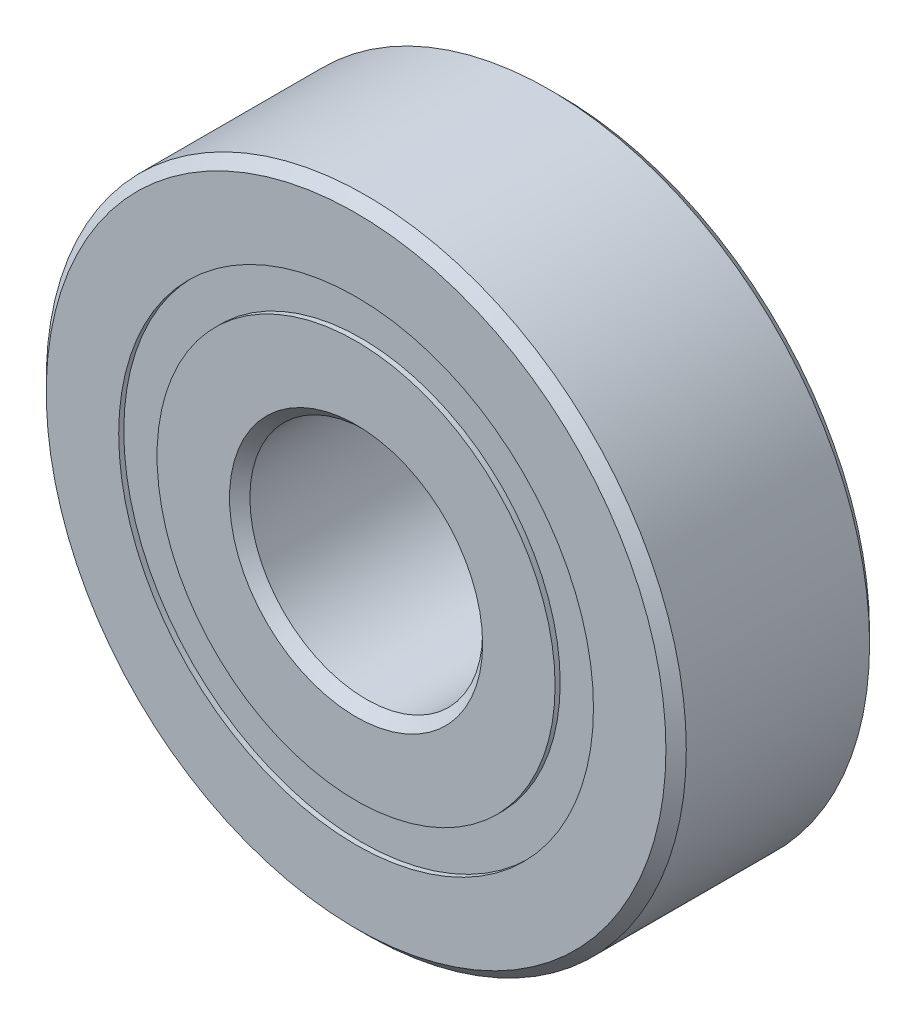
from build123d import *

# Parameters (mm, degrees)
CIRPATTERN1_COUNT = 14
SKETCH6_W         = 1.635478413
SKETCH6_H         = 1.318681318


with BuildPart() as part:
    # Sketch1 → Revolve1 (revolve)
    with BuildSketch(Plane(origin=(0, 0, 0), x_dir=(0, 0, -1), z_dir=(1, 0, 0)), mode=Mode.PRIVATE) as revolve1_sk:
        with BuildLine():
            Line((3.15, 11), (-3.15, 11))
            Line((-3.15, 11), (-3.5, 10.65))
            Line((-3.5, 10.65), (-3.5, 8.159340659))
            Line((-3.5, 8.159340659), (-1.555555556, 8.159340659))
            ThreePointArc((-1.555555556, 8.159340659), (0, 9.189521587), (1.555555556, 8.159340659))
            Line((1.555555556, 8.159340659), (3.5, 8.159340659))
            Line((3.5, 8.159340659), (3.5, 10.65))
            Line((3.5, 10.65), (3.15, 11))
        make_face()
    revolve(revolve1_sk.sketch.rotate(Axis((0, 0, 3.5), (0, 0, -1)), 90), axis=Axis((0, 0, 3.5), (0, 0, -1)))


with BuildPart() as body_2:
    # Sketch3 → Revolve3 (revolve)
    with BuildSketch(Plane(origin=(0, 0, 0), x_dir=(0, 0, -1), z_dir=(1, 0, 0)), mode=Mode.PRIVATE) as revolve3_sk:
        with BuildLine():
            Line((-3.5, 6.840659341), (-1.555555556, 6.840659341))
            ThreePointArc((-1.555555556, 6.840659341), (0, 5.810478413), (1.555555556, 6.840659341))
            Line((1.555555556, 6.840659341), (3.5, 6.840659341))
            Line((3.5, 6.840659341), (3.5, 4.35))
            Line((3.5, 4.35), (3.15, 4))
            Line((3.15, 4), (-3.15, 4))
            Line((-3.15, 4), (-3.5, 4.35))
            Line((-3.5, 4.35), (-3.5, 6.840659341))
        make_face()
    revolve(revolve3_sk.sketch.rotate(Axis((0, 0, 3.5), (0, 0, -1)), 90), axis=Axis((0, 0, 3.5), (0, 0, -1)))


with BuildPart() as body_3:
    # Sketch4 → Revolve4 (revolve)
    with BuildSketch(Plane(origin=(0, 0, 0), x_dir=(0, 0, -1), z_dir=(1, 0, 0))):
        with BuildLine():
            Line((-1.689521587, 7.5), (1.689521587, 7.5))
            ThreePointArc((1.689521587, 7.5), (0, 9.189521587), (-1.689521587, 7.5))
        make_face()
    revolve(axis=Axis((0, 7.5, 1.689521587), (0, 0, -1)))


with BuildPart() as cirpattern1_1:
    # CirPattern1: pattern copy
    add(body_3.part.rotate(Axis((0, 0, 0), (0, 0, 1)), 1 * 360 / CIRPATTERN1_COUNT))


with BuildPart() as cirpattern1_2:
    # CirPattern1: pattern copy
    add(body_3.part.rotate(Axis((0, 0, 0), (0, 0, 1)), 2 * 360 / CIRPATTERN1_COUNT))


with BuildPart() as cirpattern1_3:
    # CirPattern1: pattern copy
    add(body_3.part.rotate(Axis((0, 0, 0), (0, 0, 1)), 3 * 360 / CIRPATTERN1_COUNT))


with BuildPart() as cirpattern1_4:
    # CirPattern1: pattern copy
    add(body_3.part.rotate(Axis((0, 0, 0), (0, 0, 1)), 4 * 360 / CIRPATTERN1_COUNT))


with BuildPart() as cirpattern1_5:
    # CirPattern1: pattern copy
    add(body_3.part.rotate(Axis((0, 0, 0), (0, 0, 1)), 5 * 360 / CIRPATTERN1_COUNT))


with BuildPart() as cirpattern1_6:
    # CirPattern1: pattern copy
    add(body_3.part.rotate(Axis((0, 0, 0), (0, 0, 1)), 6 * 360 / CIRPATTERN1_COUNT))


with BuildPart() as cirpattern1_7:
    # CirPattern1: pattern copy
    add(body_3.part.rotate(Axis((0, 0, 0), (0, 0, 1)), 7 * 360 / CIRPATTERN1_COUNT))


with BuildPart() as cirpattern1_8:
    # CirPattern1: pattern copy
    add(body_3.part.rotate(Axis((0, 0, 0), (0, 0, 1)), 8 * 360 / CIRPATTERN1_COUNT))


with BuildPart() as cirpattern1_9:
    # CirPattern1: pattern copy
    add(body_3.part.rotate(Axis((0, 0, 0), (0, 0, 1)), 9 * 360 / CIRPATTERN1_COUNT))


with BuildPart() as cirpattern1_10:
    # CirPattern1: pattern copy
    add(body_3.part.rotate(Axis((0, 0, 0), (0, 0, 1)), 10 * 360 / CIRPATTERN1_COUNT))


with BuildPart() as cirpattern1_11:
    # CirPattern1: pattern copy
    add(body_3.part.rotate(Axis((0, 0, 0), (0, 0, 1)), 11 * 360 / CIRPATTERN1_COUNT))


with BuildPart() as cirpattern1_12:
    # CirPattern1: pattern copy
    add(body_3.part.rotate(Axis((0, 0, 0), (0, 0, 1)), 12 * 360 / CIRPATTERN1_COUNT))


with BuildPart() as cirpattern1_13:
    # CirPattern1: pattern copy
    add(body_3.part.rotate(Axis((0, 0, 0), (0, 0, 1)), 13 * 360 / CIRPATTERN1_COUNT))


with BuildPart() as body_17:
    # Sketch6 → Revolve5 (revolve)
    with BuildSketch(Plane(origin=(0, 0, 0), x_dir=(0, 0, -1), z_dir=(1, 0, 0)), mode=Mode.PRIVATE) as revolve5_sk:
        with Locations((-2.507260794, 7.5)):
            Rectangle(SKETCH6_W, SKETCH6_H)
        with Locations((2.507260794, 7.5)):
            Rectangle(SKETCH6_W, SKETCH6_H)
    revolve(revolve5_sk.sketch.rotate(Axis((0, 0, 3.5), (0, 0, -1)), 90), axis=Axis((0, 0, 3.5), (0, 0, -1)))


solid = Compound([part.part, body_2.part, body_3.part, cirpattern1_1.part, cirpattern1_2.part, cirpattern1_3.part, cirpattern1_4.part, cirpattern1_5.part, cirpattern1_6.part, cirpattern1_7.part, cirpattern1_8.part, cirpattern1_9.part, cirpattern1_10.part, cirpattern1_11.part, cirpattern1_12.part, cirpattern1_13.part, body_17.part])
